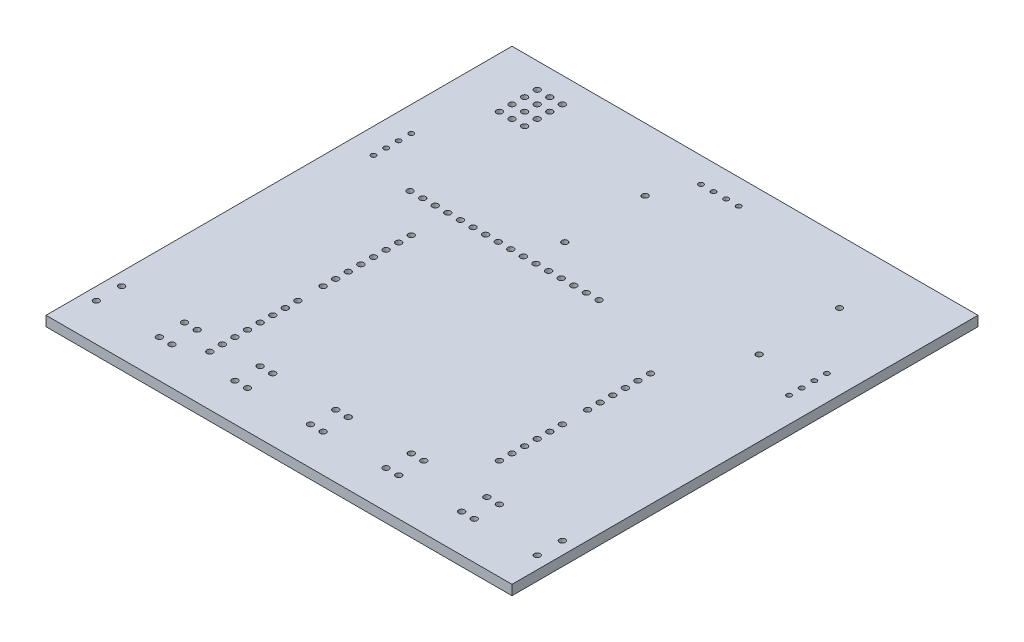
from build123d import *

# Parameters (mm, degrees)
SKETCH1_W           = 93.98
SKETCH1_H           = 93.98
BOSS_EXTRUDE1_DEPTH = 2
SKETCH2_R           = 0.6
CUT_EXTRUDE1_DEPTH  = 133.922837767
SKETCH3_R           = 0.6
CUT_EXTRUDE2_DEPTH  = 133.922837767
SKETCH4_R           = 0.5
CUT_EXTRUDE3_DEPTH  = 133.922837767
SKETCH5_R           = 0.6
CUT_EXTRUDE4_DEPTH  = 133.922837767
SKETCH6_R           = 0.6
CUT_EXTRUDE5_DEPTH  = 10
SKETCH7_R           = 0.6
CUT_EXTRUDE6_DEPTH  = 133.922837767


with BuildPart() as part:
    # Sketch1 → Boss-Extrude1 (new body)
    with BuildSketch(Plane(origin=(0, 0, 0), x_dir=(1, 0, 0), z_dir=(0, 1, 0))):
        with Locations((46.99, 46.99)):
            Rectangle(SKETCH1_W, SKETCH1_H)
    extrude(amount=BOSS_EXTRUDE1_DEPTH)

    # Sketch2 → Cut-Extrude1 (cut, through all)
    with BuildSketch(Plane(origin=(0, 2, 0), x_dir=(1, 0, 0), z_dir=(0, 1, 0))):
        with Locations(Location((22.86, 50.8, 0), (0, 0, 270))):
            Circle(SKETCH2_R)
        with Locations(Location((22.86, 48.26, 0), (0, 0, 270))):
            Circle(SKETCH2_R)
        with Locations(Location((22.86, 45.72, 0), (0, 0, 270))):
            Circle(SKETCH2_R)
        with Locations(Location((22.86, 43.18, 0), (0, 0, 270))):
            Circle(SKETCH2_R)
        with Locations(Location((22.86, 40.64, 0), (0, 0, 270))):
            Circle(SKETCH2_R)
        with Locations(Location((22.86, 38.1, 0), (0, 0, 270))):
            Circle(SKETCH2_R)
        with Locations(Location((22.86, 35.56, 0), (0, 0, 270))):
            Circle(SKETCH2_R)
        with Locations(Location((22.86, 33.02, 0), (0, 0, 270))):
            Circle(SKETCH2_R)
        with Locations(Location((22.86, 27.94, 0), (0, 0, 270))):
            Circle(SKETCH2_R)
        with Locations(Location((22.86, 25.4, 0), (0, 0, 270))):
            Circle(SKETCH2_R)
        with Locations(Location((22.86, 22.86, 0), (0, 0, 270))):
            Circle(SKETCH2_R)
        with Locations(Location((22.86, 20.32, 0), (0, 0, 270))):
            Circle(SKETCH2_R)
        with Locations(Location((22.86, 17.78, 0), (0, 0, 270))):
            Circle(SKETCH2_R)
        with Locations(Location((22.86, 15.24, 0), (0, 0, 270))):
            Circle(SKETCH2_R)
        with Locations(Location((22.86, 12.7, 0), (0, 0, 270))):
            Circle(SKETCH2_R)
        with Locations(Location((22.86, 10.16, 0), (0, 0, 270))):
            Circle(SKETCH2_R)
        with Locations(Location((71.12, 50.8, 0), (0, 0, 270))):
            Circle(SKETCH2_R)
        with Locations(Location((71.12, 48.26, 0), (0, 0, 270))):
            Circle(SKETCH2_R)
        with Locations(Location((71.12, 45.72, 0), (0, 0, 270))):
            Circle(SKETCH2_R)
        with Locations(Location((71.12, 43.18, 0), (0, 0, 270))):
            Circle(SKETCH2_R)
        with Locations(Location((71.12, 40.64, 0), (0, 0, 270))):
            Circle(SKETCH2_R)
        with Locations(Location((71.12, 38.1, 0), (0, 0, 270))):
            Circle(SKETCH2_R)
        with Locations(Location((71.12, 33.02, 0), (0, 0, 270))):
            Circle(SKETCH2_R)
        with Locations(Location((71.12, 30.48, 0), (0, 0, 270))):
            Circle(SKETCH2_R)
        with Locations(Location((71.12, 27.94, 0), (0, 0, 270))):
            Circle(SKETCH2_R)
        with Locations(Location((71.12, 25.4, 0), (0, 0, 270))):
            Circle(SKETCH2_R)
        with Locations(Location((71.12, 22.86, 0), (0, 0, 270))):
            Circle(SKETCH2_R)
        with Locations(Location((71.12, 20.32, 0), (0, 0, 270))):
            Circle(SKETCH2_R)
    extrude(amount=-CUT_EXTRUDE1_DEPTH, mode=Mode.SUBTRACT)

    # Sketch3 → Cut-Extrude2 (cut, through all)
    with BuildSketch(Plane.XZ):
        with Locations(Location((15, -58.42, 0), (0, 0, 270))):
            Circle(SKETCH3_R)
        with Locations(Location((17.54, -58.42, 0), (0, 0, 270))):
            Circle(SKETCH3_R)
        with Locations(Location((20.08, -58.42, 0), (0, 0, 270))):
            Circle(SKETCH3_R)
        with Locations(Location((22.62, -58.42, 0), (0, 0, 270))):
            Circle(SKETCH3_R)
        with Locations(Location((25.16, -58.42, 0), (0, 0, 270))):
            Circle(SKETCH3_R)
        with Locations(Location((27.7, -58.42, 0), (0, 0, 270))):
            Circle(SKETCH3_R)
        with Locations(Location((30.24, -58.42, 0), (0, 0, 270))):
            Circle(SKETCH3_R)
        with Locations(Location((32.78, -58.42, 0), (0, 0, 270))):
            Circle(SKETCH3_R)
        with Locations(Location((35.32, -58.42, 0), (0, 0, 270))):
            Circle(SKETCH3_R)
        with Locations(Location((37.86, -58.42, 0), (0, 0, 270))):
            Circle(SKETCH3_R)
        with Locations(Location((40.4, -58.42, 0), (0, 0, 270))):
            Circle(SKETCH3_R)
        with Locations(Location((42.94, -58.42, 0), (0, 0, 270))):
            Circle(SKETCH3_R)
        with Locations(Location((45.48, -58.42, 0), (0, 0, 270))):
            Circle(SKETCH3_R)
        with Locations(Location((48.02, -58.42, 0), (0, 0, 270))):
            Circle(SKETCH3_R)
        with Locations(Location((50.56, -58.42, 0), (0, 0, 270))):
            Circle(SKETCH3_R)
        with Locations(Location((53.1, -58.42, 0), (0, 0, 270))):
            Circle(SKETCH3_R)
    extrude(amount=-CUT_EXTRUDE2_DEPTH, mode=Mode.SUBTRACT)

    # Sketch4 → Cut-Extrude3 (cut, through all)
    with BuildSketch(Plane.XZ):
        with Locations(Location((5.08, -60.96, 0), (0, 0, 270))):
            Circle(SKETCH4_R)
        with Locations(Location((5.08, -63.5, 0), (0, 0, 270))):
            Circle(SKETCH4_R)
        with Locations(Location((5.08, -66.04, 0), (0, 0, 270))):
            Circle(SKETCH4_R)
        with Locations(Location((5.08, -68.58, 0), (0, 0, 270))):
            Circle(SKETCH4_R)
        with Locations(Location((88.9, -68.58, 0), (0, 0, 90))):
            Circle(SKETCH4_R)
        with Locations(Location((88.9, -66.04, 0), (0, 0, 90))):
            Circle(SKETCH4_R)
        with Locations(Location((88.9, -63.5, 0), (0, 0, 90))):
            Circle(SKETCH4_R)
        with Locations(Location((88.9, -60.96, 0), (0, 0, 90))):
            Circle(SKETCH4_R)
        with Locations(Location((43.18, -88.9, 0), (0, 0, 270))):
            Circle(SKETCH4_R)
        with Locations(Location((45.72, -88.9, 0), (0, 0, 270))):
            Circle(SKETCH4_R)
        with Locations(Location((48.26, -88.9, 0), (0, 0, 270))):
            Circle(SKETCH4_R)
        with Locations(Location((50.8, -88.9, 0), (0, 0, 270))):
            Circle(SKETCH4_R)
    extrude(amount=-CUT_EXTRUDE3_DEPTH, mode=Mode.SUBTRACT)

    # Sketch5 → Cut-Extrude4 (cut, through all)
    with BuildSketch(Plane(origin=(0, 2, 0), x_dir=(1, 0, 0), z_dir=(0, 1, 0))):
        with Locations(Location((78.74, 81.28, 0), (0, 0, 270))):
            Circle(SKETCH5_R)
        with Locations(Location((39.54, 81.28, 0), (0, 0, 270))):
            Circle(SKETCH5_R)
        with Locations(Location((39.54, 65.08, 0), (0, 0, 270))):
            Circle(SKETCH5_R)
        with Locations(Location((78.74, 65.08, 0), (0, 0, 270))):
            Circle(SKETCH5_R)
    extrude(amount=-CUT_EXTRUDE4_DEPTH, mode=Mode.SUBTRACT)

    # Sketch6 → Cut-Extrude5 (cut)
    with BuildSketch(Plane(origin=(0, 2, 0), x_dir=(1, 0, 0), z_dir=(0, 1, 0))):
        with Locations(Location((10.16, 88.9, 0), (0, 0, 270))):
            Circle(SKETCH6_R)
        with Locations(Location((12.7, 88.9, 0), (0, 0, 270))):
            Circle(SKETCH6_R)
        with Locations(Location((15.24, 88.9, 0), (0, 0, 270))):
            Circle(SKETCH6_R)
        with Locations(Location((12.7, 86.36, 0), (0, 0, 270))):
            Circle(SKETCH6_R)
        with Locations(Location((15.24, 86.36, 0), (0, 0, 270))):
            Circle(SKETCH6_R)
        with Locations(Location((12.7, 83.82, 0), (0, 0, 270))):
            Circle(SKETCH6_R)
        with Locations(Location((15.24, 83.82, 0), (0, 0, 270))):
            Circle(SKETCH6_R)
        with Locations(Location((12.7, 81.28, 0), (0, 0, 270))):
            Circle(SKETCH6_R)
        with Locations(Location((15.24, 81.28, 0), (0, 0, 270))):
            Circle(SKETCH6_R)
        with Locations(Location((10.16, 86.36, 0), (0, 0, 270))):
            Circle(SKETCH6_R)
        with Locations(Location((10.16, 83.82, 0), (0, 0, 270))):
            Circle(SKETCH6_R)
        with Locations(Location((10.16, 81.28, 0), (0, 0, 270))):
            Circle(SKETCH6_R)
    extrude(amount=-CUT_EXTRUDE5_DEPTH, mode=Mode.SUBTRACT)

    # Sketch7 → Cut-Extrude6 (cut, through all)
    with BuildSketch(Plane(origin=(0, 2, 0), x_dir=(1, 0, 0), z_dir=(0, 1, 0))):
        with Locations(Location((15.24, 12.7, 0), (0, 0, 270))):
            Circle(SKETCH7_R)
        with Locations(Location((15.24, 7.62, 0), (0, 0, 270))):
            Circle(SKETCH7_R)
        with Locations(Location((2.54, 12.7, 0), (0, 0, 270))):
            Circle(SKETCH7_R)
        with Locations(Location((2.54, 7.62, 0), (0, 0, 270))):
            Circle(SKETCH7_R)
        with Locations(Location((30.48, 12.7, 0), (0, 0, 270))):
            Circle(SKETCH7_R)
        with Locations(Location((30.48, 7.62, 0), (0, 0, 270))):
            Circle(SKETCH7_R)
        with Locations(Location((17.78, 12.7, 0), (0, 0, 270))):
            Circle(SKETCH7_R)
        with Locations(Location((17.78, 7.62, 0), (0, 0, 270))):
            Circle(SKETCH7_R)
        with Locations(Location((45.72, 12.7, 0), (0, 0, 270))):
            Circle(SKETCH7_R)
        with Locations(Location((45.72, 7.62, 0), (0, 0, 270))):
            Circle(SKETCH7_R)
        with Locations(Location((33.02, 12.7, 0), (0, 0, 270))):
            Circle(SKETCH7_R)
        with Locations(Location((33.02, 7.62, 0), (0, 0, 270))):
            Circle(SKETCH7_R)
        with Locations(Location((60.96, 12.7, 0), (0, 0, 270))):
            Circle(SKETCH7_R)
        with Locations(Location((60.96, 7.62, 0), (0, 0, 270))):
            Circle(SKETCH7_R)
        with Locations(Location((48.26, 12.7, 0), (0, 0, 270))):
            Circle(SKETCH7_R)
        with Locations(Location((48.26, 7.62, 0), (0, 0, 270))):
            Circle(SKETCH7_R)
        with Locations(Location((76.2, 12.7, 0), (0, 0, 270))):
            Circle(SKETCH7_R)
        with Locations(Location((76.2, 7.62, 0), (0, 0, 270))):
            Circle(SKETCH7_R)
        with Locations(Location((63.5, 12.7, 0), (0, 0, 270))):
            Circle(SKETCH7_R)
        with Locations(Location((63.5, 7.62, 0), (0, 0, 270))):
            Circle(SKETCH7_R)
        with Locations(Location((91.44, 12.7, 0), (0, 0, 270))):
            Circle(SKETCH7_R)
        with Locations(Location((91.44, 7.62, 0), (0, 0, 270))):
            Circle(SKETCH7_R)
        with Locations(Location((78.74, 12.7, 0), (0, 0, 270))):
            Circle(SKETCH7_R)
        with Locations(Location((78.74, 7.62, 0), (0, 0, 270))):
            Circle(SKETCH7_R)
    extrude(amount=-CUT_EXTRUDE6_DEPTH, mode=Mode.SUBTRACT)


solid = part.part
